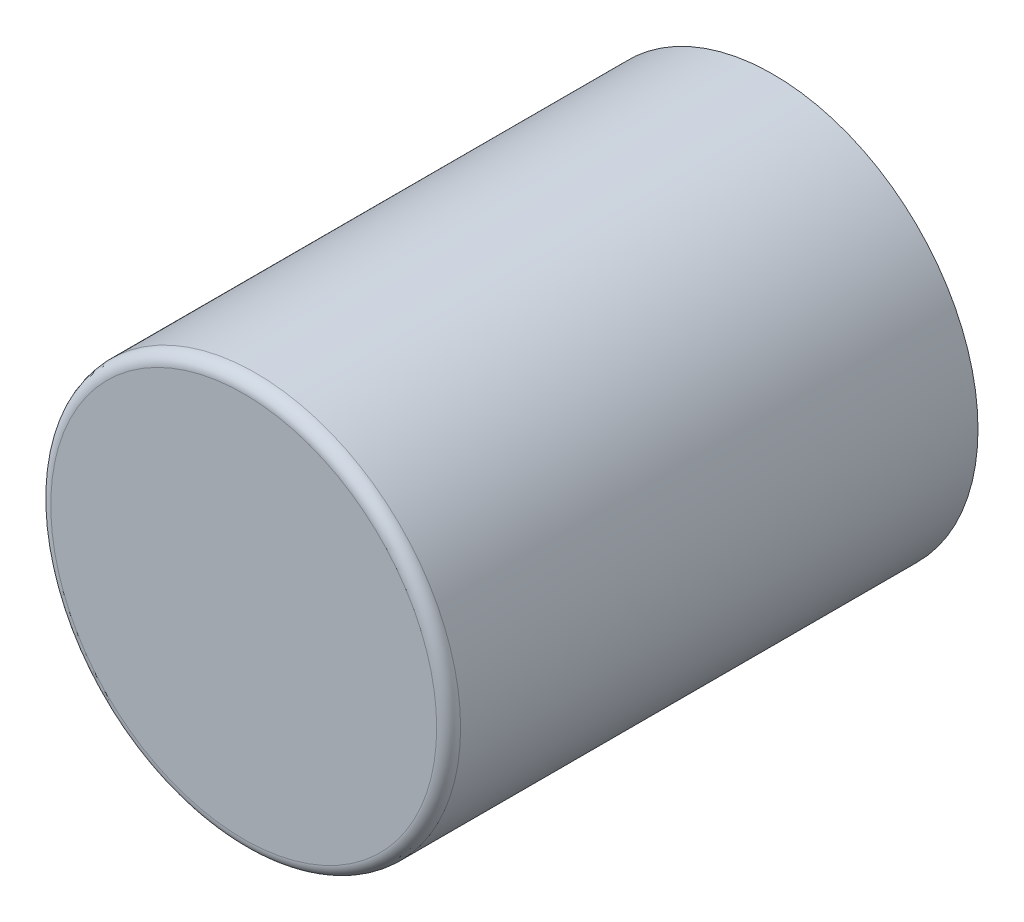
from build123d import *

# Parameters (mm, degrees)
CROQUIS1_R              = 12
SALIENTE_EXTRUIR1_DEPTH = 31
REDONDEO2_R             = 0.7


with BuildPart() as part:
    # Croquis1 → Saliente-Extruir1 (new body)
    with BuildSketch(Plane.XY):
        Circle(CROQUIS1_R)
    extrude(amount=SALIENTE_EXTRUIR1_DEPTH)

    # Redondeo2
    redondeo2_edges = [part.edges().sort_by_distance(p)[0] for p in [
        (-12, 0, 31),
    ]]
    fillet(redondeo2_edges, radius=REDONDEO2_R)


solid = part.part
